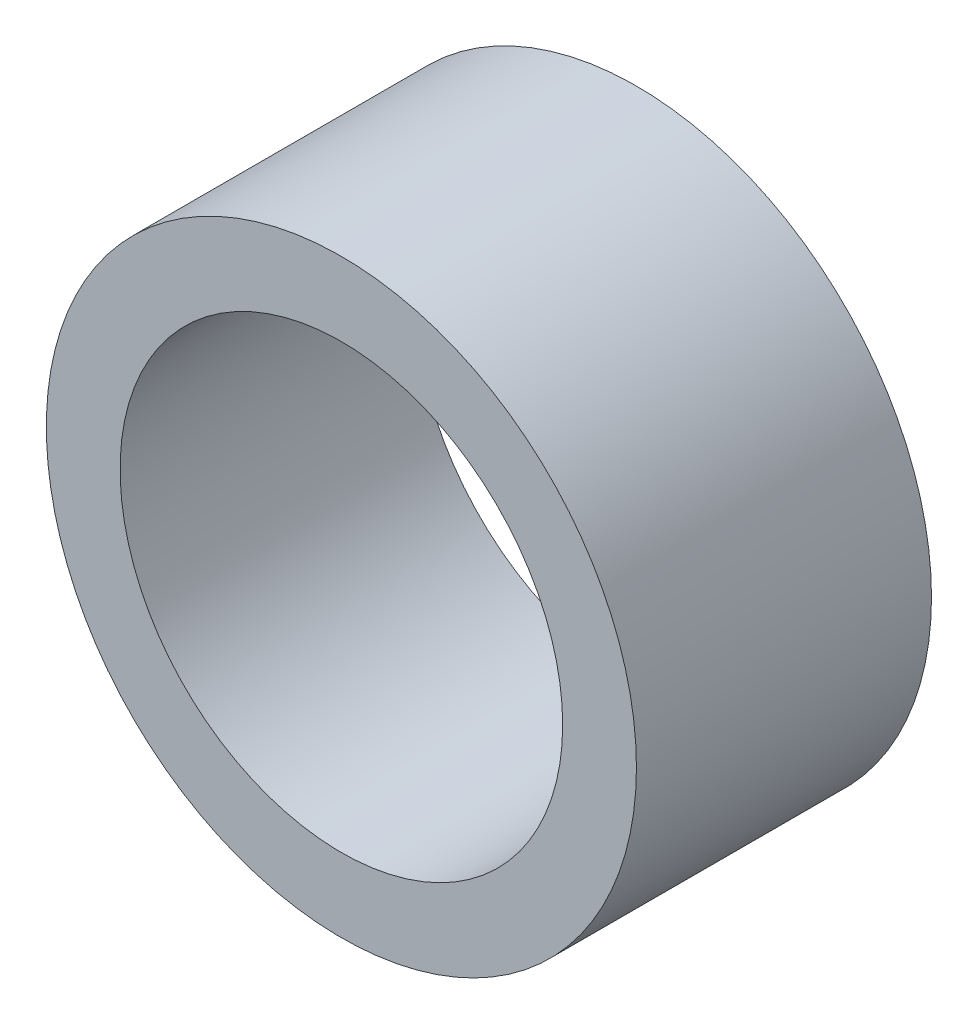
from build123d import *

# Parameters (mm, degrees)
SKETCH1_R      = 12.7
SKETCH1_R_2    = 9.525
EXTRUDE1_DEPTH = 12.7


with BuildPart() as part:
    # Sketch1 → Extrude1 (new body)
    with BuildSketch(Plane.XY):
        Circle(SKETCH1_R)
        Circle(SKETCH1_R_2, mode=Mode.SUBTRACT)
    extrude(amount=EXTRUDE1_DEPTH)


solid = part.part
